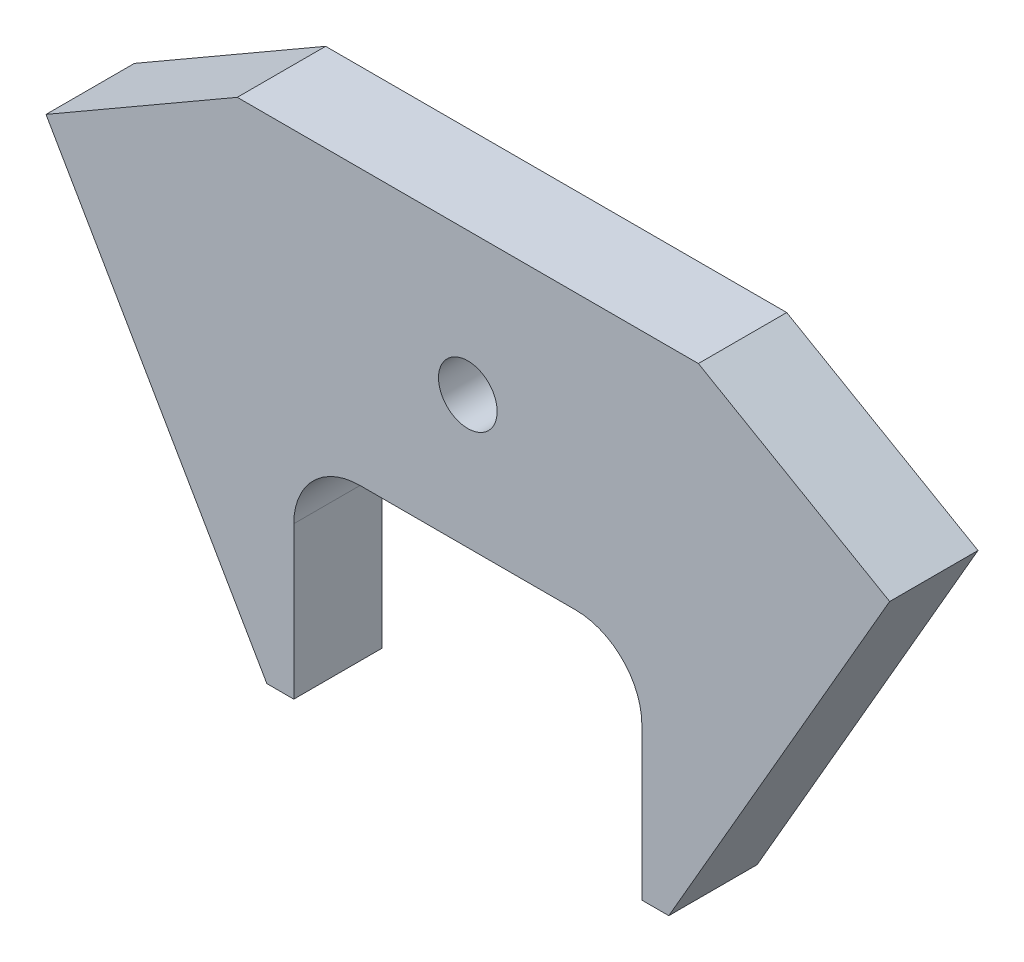
from build123d import *

# Parameters (mm, degrees)
BOSS_EXTRUDE1_DEPTH      = 12.7
FILLET1_R                = 9.525
F_5_16_CLEARANCE_HOLE1_D = 8.4328


with BuildPart() as part:
    # Sketch1 → Boss-Extrude1 (new body)
    with BuildSketch(Plane.XY):
        Polygon((25.019, 0), (28.88945277, 0), (60.63945277, 54.99261314), (33.1431462, 70.86761314), (-33.1431462, 70.86761314), (-60.63945277, 54.99261314), (-28.88945277, 0), (-25.019, 0), (-25.019, 31.369), (25.019, 31.369), align=None)
    extrude(amount=BOSS_EXTRUDE1_DEPTH)

    # Fillet1
    fillet1_edges = [part.edges().sort_by_distance(p)[0] for p in [
        (25.019, 31.369, 6.35),
        (-25.019, 31.369, 6.35),
    ]]
    fillet(fillet1_edges, radius=FILLET1_R)

    # 5/16 Clearance Hole1 (through all)
    with Locations(Plane(origin=(0, 0, 0), x_dir=(-1, 0, 0), z_dir=(0, 0, -1))):
        with Locations((0, 50.419)):
            Hole(F_5_16_CLEARANCE_HOLE1_D / 2)


solid = part.part
